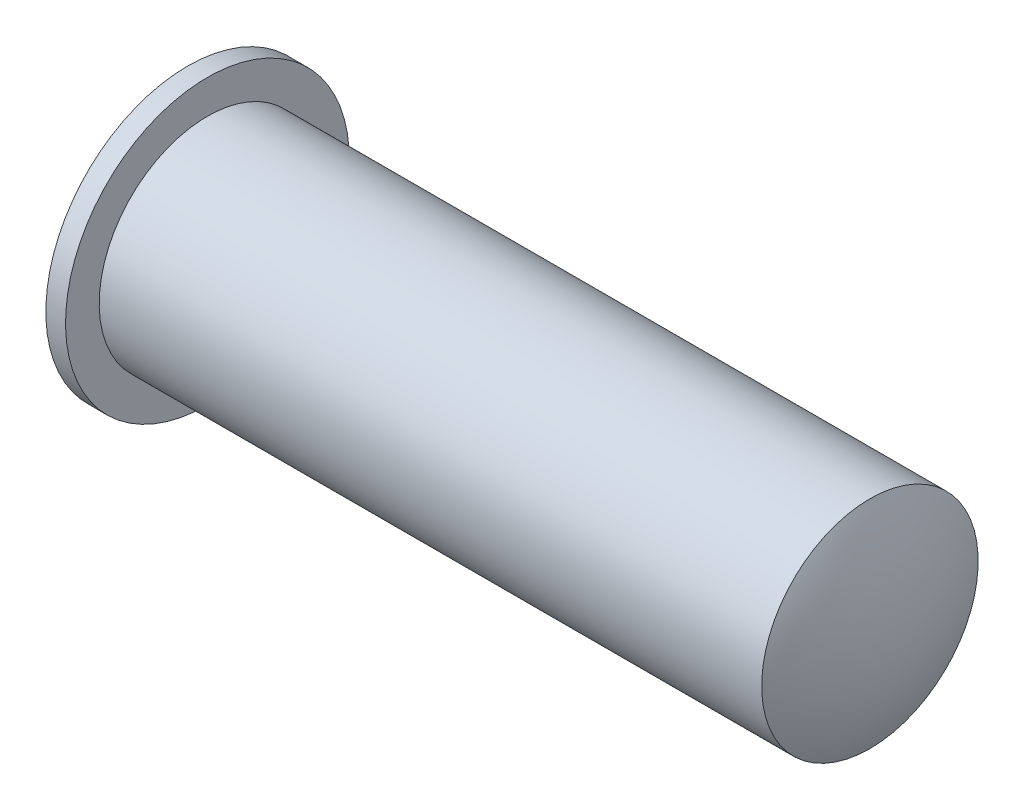
from build123d import *


with BuildPart() as part:
    # 草图1 → 旋转1 (revolve)
    with BuildSketch(Plane.XY):
        with BuildLine():
            Line((0, 7.211102551), (1, 7.211102551))
            Line((1, 7.211102551), (1, 5.5))
            Line((1, 5.5), (34.665364504, 5.5))
            ThreePointArc((34.665364504, 5.5), (35.661568806, 2.82980794), (36, 0))
            Line((36, 0), (-2, 0))
            ThreePointArc((-2, 0), (-1.490737563, 3.741657387), (0, 7.211102551))
        make_face()
    revolve(axis=Axis((-2, 0, 0), (1, 0, 0)))


solid = part.part
